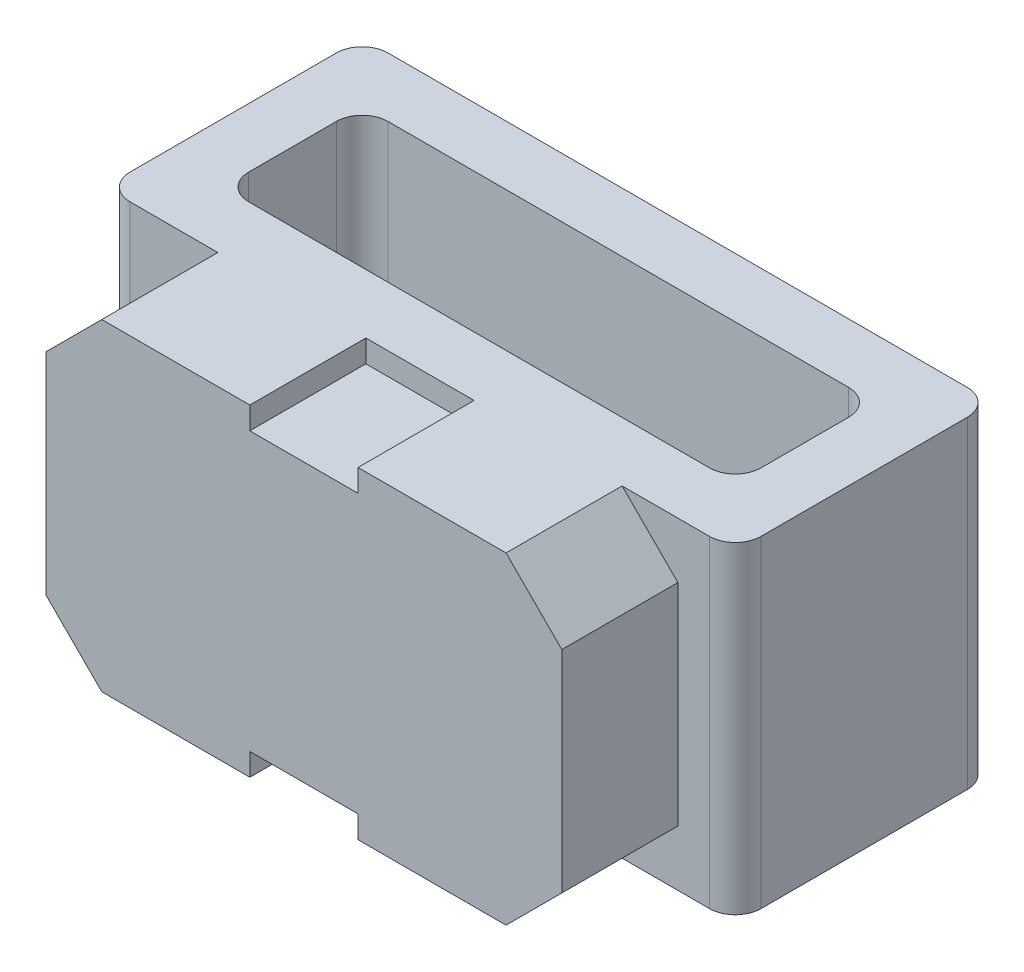
from build123d import *

# Parameters (mm, degrees)
BOSS_EXTRUDE1_DEPTH = 0.45
SKETCH3_W           = 2.44643867
SKETCH3_H           = 1
SKETCH3_W_2         = 1.98643867
SKETCH3_H_2         = 0.54
BOSS_EXTRUDE2_DEPTH = 0.625
FILLET1_R           = 0.1


with BuildPart() as part:
    # Sketch2 → Boss-Extrude1 (new body)
    with BuildSketch(Plane.XY):
        Polygon((-1, -0.408686365), (-1, 0.408686365), (-0.783686365, 0.625), (-0.209757083, 0.625), (-0.209757083, 0.53827251), (0.209757083, 0.53827251), (0.209757083, 0.625), (0.783686365, 0.625), (1, 0.408686365), (1, -0.408686365), (0.783686365, -0.625), (0.209757083, -0.625), (0.209757083, -0.53827251), (-0.209757083, -0.53827251), (-0.209757083, -0.625), (-0.783686365, -0.625), align=None)
    extrude(amount=BOSS_EXTRUDE1_DEPTH)

    # Sketch3 → Boss-Extrude2 (add, symmetric)
    with BuildSketch(Plane(origin=(0, 0, 0), x_dir=(1, 0, 0), z_dir=(0, 1, 0))):
        with Locations((-0.000865872, 0.5)):
            Rectangle(SKETCH3_W, SKETCH3_H)
        with Locations((-0.000865872, 0.5)):
            Rectangle(SKETCH3_W_2, SKETCH3_H_2, mode=Mode.SUBTRACT)
    extrude(amount=BOSS_EXTRUDE2_DEPTH, both=True)

    # Fillet1
    fillet1_edges = [part.edges().sort_by_distance(p)[0] for p in [
        (-1.224085207, 0, 0),
        (1.222353463, 0, 0),
        (1.222353463, 0, -1),
        (-1.224085207, 0, -1),
        (0.992353463, 0, -0.77),
        (-0.994085207, 0, -0.77),
        (-0.994085207, 0, -0.23),
        (0.992353463, 0, -0.23),
    ]]
    fillet(fillet1_edges, radius=FILLET1_R)


solid = part.part
